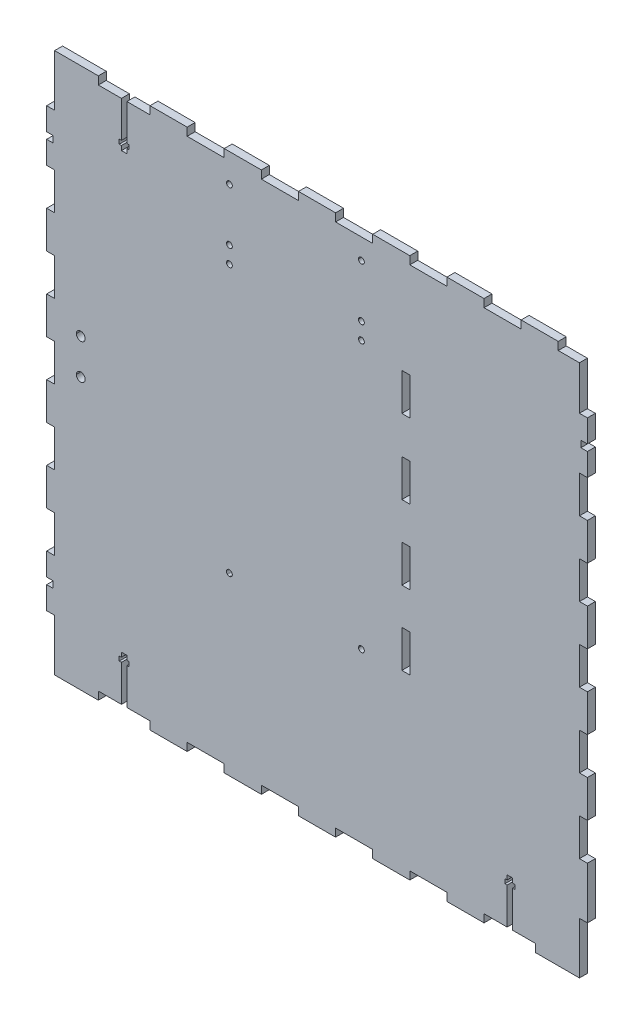
from build123d import *

# Parameters (mm, degrees)
MODEL_W             = 4.499998054
MODEL_H             = 21.091560272
MODEL_H_2           = 21.091595551
BOSS_EXTRUDE1_DEPTH = 4.5
SKETCH1_R           = 1.650029861
SKETCH1_R_2         = 1.65020625
CUT_EXTRUDE1_DEPTH  = 10


with BuildPart() as part:
    # Model → Boss-Extrude1 (new body)
    with BuildSketch(Plane.XY):
        Polygon((1019.525696134, -829.502687015), (994.775442251, -829.502687015), (994.775442251, -825.00268896), (981.700615866, -825.00268896), (981.700615866, -804.402759799), (982.950507532, -804.402759799), (982.950507532, -801.902658966), (981.700615866, -801.902658966), (981.700615866, -799.402522856), (978.600722255, -799.402522856), (978.600722255, -801.902658966), (977.350513089, -801.902658966), (977.350513089, -804.402759799), (978.600722255, -804.402759799), (978.600722255, -825.00268896), (965.52557837, -825.00268896), (965.52557837, -829.502687015), (944.525634486, -829.502687015), (944.525634486, -825.00268896), (923.52572588, -825.00268896), (923.52572588, -829.502687015), (902.525429219, -829.502687015), (902.525429219, -825.00268896), (881.525520613, -825.00268896), (881.525520613, -829.502687015), (860.525612007, -829.502687015), (860.525612007, -825.00268896), (839.525668123, -825.00268896), (839.525668123, -829.502687015), (818.525759518, -829.502687015), (818.525759518, -825.00268896), (797.525462856, -825.00268896), (797.525462856, -829.502687015), (776.52555425, -829.502687015), (776.52555425, -825.00268896), (763.450727865, -825.00268896), (763.450727865, -804.402759799), (764.700619531, -804.402759799), (764.700619531, -801.902658966), (763.450727865, -801.902658966), (763.450727865, -799.402522856), (760.350481477, -799.402522856), (760.350481477, -801.902658966), (759.100625088, -801.902658966), (759.100625088, -804.402759799), (760.350481477, -804.402759799), (760.350481477, -825.00268896), (747.275655091, -825.00268896), (747.275655091, -829.502687015), (722.525753986, -829.502687015), (722.525753986, -800.252787855), (718.025755932, -800.252787855), (718.025755932, -787.47768147), (721.725795097, -787.47768147), (721.725795097, -783.777642304), (718.025755932, -783.777642304), (718.025755932, -771.002535918), (722.525753986, -771.002535918), (722.525753986, -750.002627312), (718.025755932, -750.002627312), (718.025755932, -729.002718707), (722.525753986, -729.002718707), (722.525753986, -708.002774823), (718.025755932, -708.002774823), (718.025755932, -687.002513439), (722.525753986, -687.002513439), (722.525753986, -666.002569556), (718.025755932, -666.002569556), (718.025755932, -645.00266095), (722.525753986, -645.00266095), (722.525753986, -624.002752344), (718.025755932, -624.002752344), (718.025755932, -603.002455683), (722.525753986, -603.002455683), (722.525753986, -582.002547077), (718.025755932, -582.002547077), (718.025755932, -569.227793469), (721.725795097, -569.227793469), (721.725795097, -565.527754303), (718.025755932, -565.527754303), (718.025755932, -552.752647917), (722.525753986, -552.752647917), (722.525753986, -523.502748758), (747.275655091, -523.502748758), (747.275655091, -528.002746812), (760.350481477, -528.002746812), (760.350481477, -548.602675974), (759.100625088, -548.602675974), (759.100625088, -551.102812084), (760.350481477, -551.102812084), (760.350481477, -553.602560139), (763.450727865, -553.602560139), (763.450727865, -551.102812084), (764.700619531, -551.102812084), (764.700619531, -548.602675974), (763.450727865, -548.602675974), (763.450727865, -528.002746812), (776.52555425, -528.002746812), (776.52555425, -523.502748758), (797.525462856, -523.502748758), (797.525462856, -528.002746812), (818.525759518, -528.002746812), (818.525759518, -523.502748758), (839.525668123, -523.502748758), (839.525668123, -528.002746812), (860.525612007, -528.002746812), (860.525612007, -523.502748758), (881.525520613, -523.502748758), (881.525520613, -528.002746812), (902.525429219, -528.002746812), (902.525429219, -523.502748758), (923.52572588, -523.502748758), (923.52572588, -528.002711535), (944.525634486, -528.002711535), (944.525634486, -523.502748758), (965.52557837, -523.502748758), (965.52557837, -528.002711535), (986.525486976, -528.002711535), (986.525486976, -523.502748758), (1007.525783637, -523.502748758), (1007.525783637, -528.002711535), (1019.525696134, -528.002711535), (1019.525696134, -552.752647917), (1024.025694188, -552.752647917), (1024.025694188, -565.527754303), (1020.325655023, -565.527754303), (1020.325655023, -569.227793469), (1024.025694188, -569.227793469), (1024.025694188, -582.002547077), (1019.525696134, -582.002547077), (1019.525696134, -603.00280846), (1024.025694188, -603.00280846), (1024.025694188, -624.002752344), (1019.525696134, -624.002752344), (1019.525696134, -645.00266095), (1024.025694188, -645.00266095), (1024.025694188, -666.002569556), (1019.525696134, -666.002569556), (1019.525696134, -687.002513439), (1024.025694188, -687.002513439), (1024.025694188, -708.002774823), (1019.525696134, -708.002774823), (1019.525696134, -729.002718707), (1024.025694188, -729.002718707), (1024.025694188, -750.002627312), (1019.525696134, -750.002627312), (1019.525696134, -771.002535918), (1024.025694188, -771.002535918), (1024.025694188, -784.077715082), (1024.025694188, -787.177608692), (1024.025694188, -800.252787855), (1019.525696134, -800.252787855), (1019.525696134, -825.00268896), align=None)
        with Locations((921.275726853, -592.523526935)):
            Rectangle(MODEL_W, MODEL_H, mode=Mode.SUBTRACT)
        with Locations((921.275726853, -634.739208869)):
            Rectangle(MODEL_W, MODEL_H, mode=Mode.SUBTRACT)
        with Locations((921.275726853, -676.674802887)):
            Rectangle(MODEL_W, MODEL_H_2, mode=Mode.SUBTRACT)
        with Locations((921.275726853, -718.456920932)):
            Rectangle(MODEL_W, MODEL_H_2, mode=Mode.SUBTRACT)
        with BuildLine():
            add(Edge.make_bspline(
                [(734.825950927, -676.080689831), (734.825950927, -674.699917609), (735.94524426, -673.580588998), (737.325875371, -673.580588998), (738.706682871, -673.580588998), (739.825976204, -674.699917609), (739.825976204, -676.080689831)],
                knots=[2, 2, 2, 2, 3, 3, 3, 4, 4, 4, 4], degree=3))
            add(Edge.make_bspline(
                [(739.825976204, -676.080689831), (739.825976204, -677.461320942), (738.706682871, -678.580614275), (737.325875371, -678.580614275), (735.94524426, -678.580614275), (734.825950927, -677.461320942), (734.825950927, -676.080689831)],
                knots=[0, 0, 0, 0, 1, 1, 1, 2, 2, 2, 2], degree=3))
        make_face(mode=Mode.SUBTRACT)
        with BuildLine():
            add(Edge.make_bspline(
                [(734.825950927, -656.056599836), (734.825950927, -654.675792336), (735.94524426, -653.556499003), (737.325875371, -653.556499003), (738.706682871, -653.556499003), (739.825976204, -654.675792336), (739.825976204, -656.056599836)],
                knots=[2, 2, 2, 2, 3, 3, 3, 4, 4, 4, 4], degree=3))
            add(Edge.make_bspline(
                [(739.825976204, -656.056599836), (739.825976204, -657.437230947), (738.706682871, -658.55652428), (737.325875371, -658.55652428), (735.94524426, -658.55652428), (734.825950927, -657.437230947), (734.825950927, -656.056599836)],
                knots=[0, 0, 0, 0, 1, 1, 1, 2, 2, 2, 2], degree=3))
        make_face(mode=Mode.SUBTRACT)
        with BuildLine():
            add(Edge.make_bspline(
                [(894.49698311, -569.277923191), (894.49698311, -568.366698191), (895.235629221, -567.62805208), (896.147206998, -567.62805208), (897.05807922, -567.62805208), (897.797042831, -568.366698191), (897.797042831, -569.277923191)],
                knots=[2, 2, 2, 2, 3, 3, 3, 4, 4, 4, 4], degree=3))
            add(Edge.make_bspline(
                [(897.797042831, -569.277923191), (897.797042831, -570.189148191), (897.05807922, -570.928111802), (896.147206998, -570.928111802), (895.235629221, -570.928111802), (894.49698311, -570.189148191), (894.49698311, -569.277923191)],
                knots=[0, 0, 0, 0, 1, 1, 1, 2, 2, 2, 2], degree=3))
        make_face(mode=Mode.SUBTRACT)
        with BuildLine():
            add(Edge.make_bspline(
                [(819.796994239, -569.277923191), (819.796994239, -568.366698191), (820.535605073, -567.62805208), (821.44718285, -567.62805208), (822.35809035, -567.62805208), (823.097053961, -568.366698191), (823.097053961, -569.277923191)],
                knots=[2, 2, 2, 2, 3, 3, 3, 4, 4, 4, 4], degree=3))
            add(Edge.make_bspline(
                [(823.097053961, -569.277923191), (823.097053961, -570.189148191), (822.35809035, -570.928111802), (821.44718285, -570.928111802), (820.535605073, -570.928111802), (819.796994239, -570.189148191), (819.796994239, -569.277923191)],
                knots=[0, 0, 0, 0, 1, 1, 1, 2, 2, 2, 2], degree=3))
        make_face(mode=Mode.SUBTRACT)
        with BuildLine():
            add(Edge.make_bspline(
                [(819.796994239, -539.577738476), (819.796994239, -538.666513476), (820.535605073, -537.927902643), (821.44718285, -537.927902643), (822.35809035, -537.927902643), (823.097053961, -538.666513476), (823.097053961, -539.577738476)],
                knots=[2, 2, 2, 2, 3, 3, 3, 4, 4, 4, 4], degree=3))
            add(Edge.make_bspline(
                [(823.097053961, -539.577738476), (823.097053961, -540.488963476), (822.35809035, -541.227962365), (821.44718285, -541.227962365), (820.535605073, -541.227962365), (819.796994239, -540.488963476), (819.796994239, -539.577738476)],
                knots=[0, 0, 0, 0, 1, 1, 1, 2, 2, 2, 2], degree=3))
        make_face(mode=Mode.SUBTRACT)
        with BuildLine():
            add(Edge.make_bspline(
                [(894.49698311, -539.577738476), (894.49698311, -538.666513476), (895.235629221, -537.927902643), (896.147206998, -537.927902643), (897.05807922, -537.927902643), (897.797042831, -538.666513476), (897.797042831, -539.577738476)],
                knots=[2, 2, 2, 2, 3, 3, 3, 4, 4, 4, 4], degree=3))
            add(Edge.make_bspline(
                [(897.797042831, -539.577738476), (897.797042831, -540.488963476), (897.05807922, -541.227962365), (896.147206998, -541.227962365), (895.235629221, -541.227962365), (894.49698311, -540.488963476), (894.49698311, -539.577738476)],
                knots=[0, 0, 0, 0, 1, 1, 1, 2, 2, 2, 2], degree=3))
        make_face(mode=Mode.SUBTRACT)
        with BuildLine():
            add(Edge.make_bspline(
                [(894.49698311, -578.730921244), (894.49698311, -577.819696244), (895.235629221, -577.081050134), (896.147206998, -577.081050134), (897.05807922, -577.081050134), (897.797042831, -577.819696244), (897.797042831, -578.730921244)],
                knots=[2, 2, 2, 2, 3, 3, 3, 4, 4, 4, 4], degree=3))
            add(Edge.make_bspline(
                [(897.797042831, -578.730921244), (897.797042831, -579.642146244), (897.05807922, -580.381109855), (896.147206998, -580.381109855), (895.235629221, -580.381109855), (894.49698311, -579.642146244), (894.49698311, -578.730921244)],
                knots=[0, 0, 0, 0, 1, 1, 1, 2, 2, 2, 2], degree=3))
        make_face(mode=Mode.SUBTRACT)
        with BuildLine():
            add(Edge.make_bspline(
                [(819.796994239, -578.730921244), (819.796994239, -577.819696244), (820.535605073, -577.081050134), (821.44718285, -577.081050134), (822.35809035, -577.081050134), (823.097053961, -577.819696244), (823.097053961, -578.730921244)],
                knots=[2, 2, 2, 2, 3, 3, 3, 4, 4, 4, 4], degree=3))
            add(Edge.make_bspline(
                [(823.097053961, -578.730921244), (823.097053961, -579.642146244), (822.35809035, -580.381109855), (821.44718285, -580.381109855), (820.535605073, -580.381109855), (819.796994239, -579.642146244), (819.796994239, -578.730921244)],
                knots=[0, 0, 0, 0, 1, 1, 1, 2, 2, 2, 2], degree=3))
        make_face(mode=Mode.SUBTRACT)
        with BuildLine():
            add(Edge.make_bspline(
                [(819.796994239, -730.060875651), (819.796994239, -729.149650651), (820.535781462, -728.41100454), (821.447359239, -728.41100454), (822.358231461, -728.41100454), (823.097406739, -729.149650651), (823.097406739, -730.060875651)],
                knots=[2, 2, 2, 2, 3, 3, 3, 4, 4, 4, 4], degree=3))
            add(Edge.make_bspline(
                [(823.097406739, -730.060875651), (823.097406739, -730.972100651), (822.358231461, -731.711064262), (821.447359239, -731.711064262), (820.535781462, -731.711064262), (819.796994239, -730.972100651), (819.796994239, -730.060875651)],
                knots=[0, 0, 0, 0, 1, 1, 1, 2, 2, 2, 2], degree=3))
        make_face(mode=Mode.SUBTRACT)
        with BuildLine():
            add(Edge.make_bspline(
                [(894.49698311, -730.060875651), (894.49698311, -729.149650651), (895.235629221, -728.41100454), (896.147206998, -728.41100454), (897.05807922, -728.41100454), (897.797395609, -729.149650651), (897.797395609, -730.060875651)],
                knots=[2, 2, 2, 2, 3, 3, 3, 4, 4, 4, 4], degree=3))
            add(Edge.make_bspline(
                [(897.797395609, -730.060875651), (897.797395609, -730.972100651), (897.05807922, -731.711064262), (896.147206998, -731.711064262), (895.235629221, -731.711064262), (894.49698311, -730.972100651), (894.49698311, -730.060875651)],
                knots=[0, 0, 0, 0, 1, 1, 1, 2, 2, 2, 2], degree=3))
        make_face(mode=Mode.SUBTRACT)
    extrude(amount=BOSS_EXTRUDE1_DEPTH)

    # Sketch1 → Cut-Extrude1 (cut)
    with BuildSketch(Plane.XY.offset(4.5)):
        with Locations((896.14701297, -578.730921244)):
            Circle(SKETCH1_R)
        with Locations((821.447200489, -730.060875651)):
            Circle(SKETCH1_R_2)
    extrude(amount=-CUT_EXTRUDE1_DEPTH, mode=Mode.SUBTRACT)


solid = part.part
